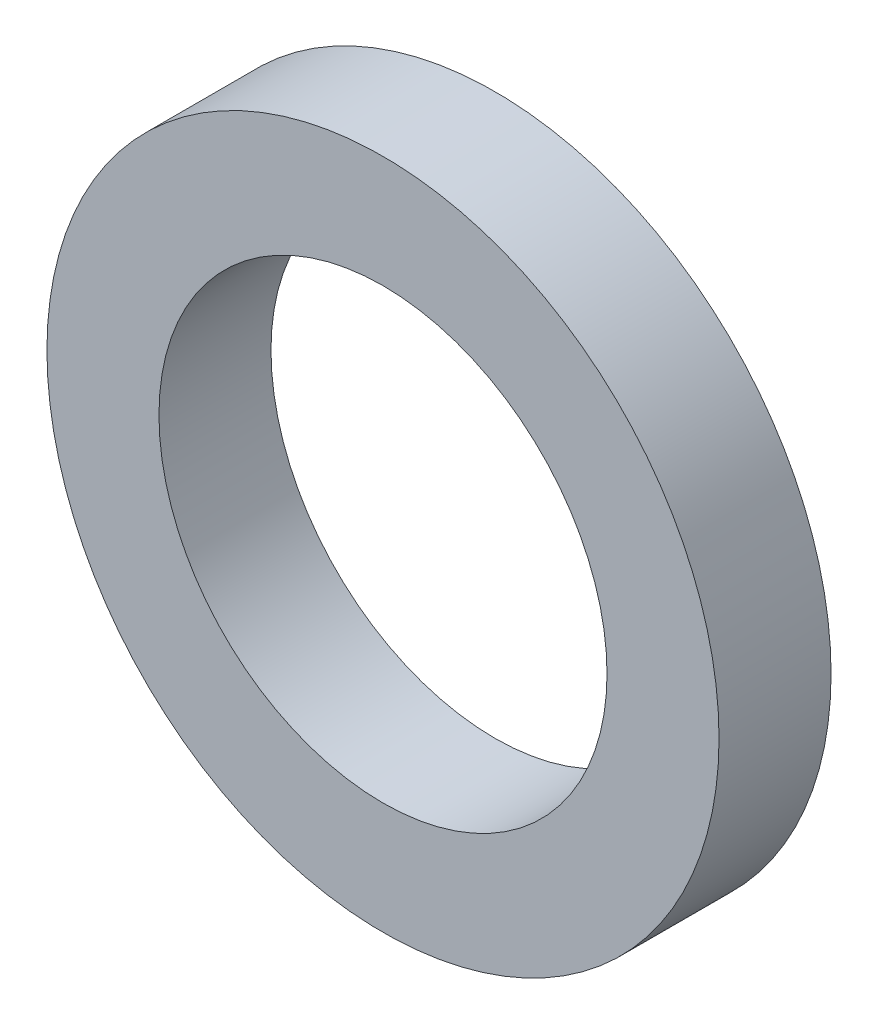
from build123d import *

# Parameters (mm, degrees)
SKETCH_1_R      = 3
SKETCH_1_R_2    = 2
EXTRUDE_1_DEPTH = 1


with BuildPart() as part:
    # 草图1 → 拉伸-薄壁1 (new body)
    with BuildSketch(Plane.XY):
        Circle(SKETCH_1_R)
        Circle(SKETCH_1_R_2, mode=Mode.SUBTRACT)
    extrude(amount=EXTRUDE_1_DEPTH)


solid = part.part
